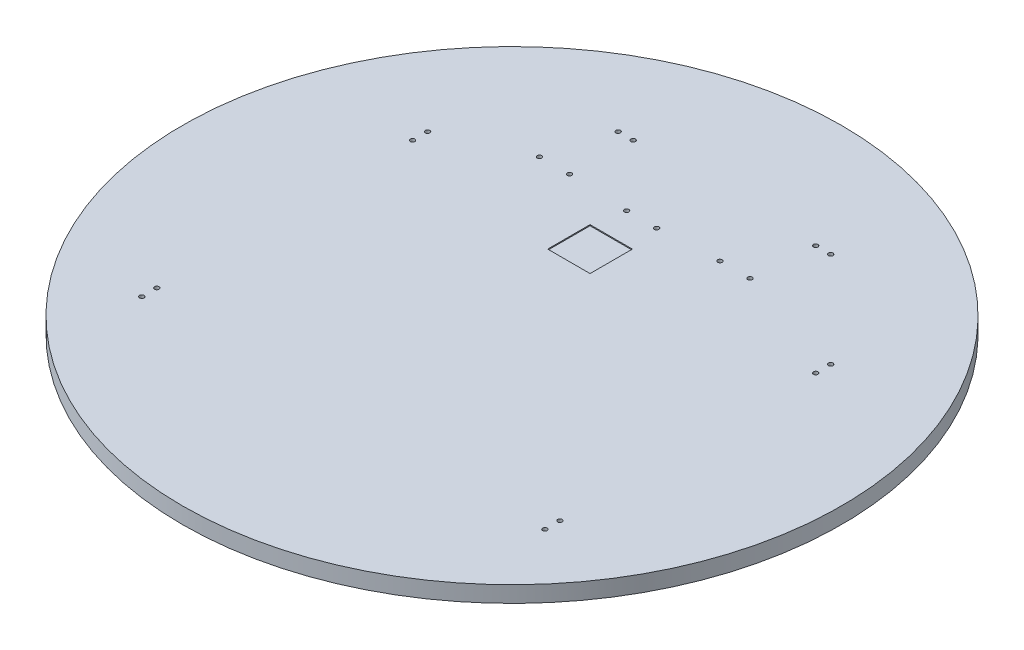
from build123d import *

# Parameters (mm, degrees)
SKETCH1_R           = 328.6125
BOSS_EXTRUDE1_DEPTH = 16.1798
SKETCH3_R           = 2.25
CUT_EXTRUDE1_DEPTH  = 780.013065513
SKETCH4_W           = 42.25
SKETCH4_H           = 42.25
CUT_EXTRUDE2_DEPTH  = 1
SKETCH5_R           = 3.75
CUT_EXTRUDE3_DEPTH  = 7.5


with BuildPart() as part:
    # Sketch1 → Boss-Extrude1 (new body)
    with BuildSketch(Plane(origin=(0, 0, 0), x_dir=(1, 0, 0), z_dir=(0, 1, 0))):
        with Locations(Location((216.675, 227.5, 0), (0, 0, 270))):
            Circle(SKETCH1_R)
    extrude(amount=BOSS_EXTRUDE1_DEPTH)

    # Sketch3 → Cut-Extrude1 (cut, through all)
    with BuildSketch(Plane(origin=(0, 16.1798, 0), x_dir=(1, 0, 0), z_dir=(0, 1, 0))):
        with Locations(Location((322.675, 439.325, 0), (0, 0, 270))):
            Circle(SKETCH3_R)
        with Locations(Location((307.675, 439.325, 0), (0, 0, 270))):
            Circle(SKETCH3_R)
        with Locations(Location((110.675, 439.325, 0), (0, 0, 270))):
            Circle(SKETCH3_R)
        with Locations(Location((125.675, 439.325, 0), (0, 0, 270))):
            Circle(SKETCH3_R)
        with Locations(Location((183.215, 375.2, 0), (0, 0, 270))):
            Circle(SKETCH3_R)
        with Locations(Location((213.215, 375.2, 0), (0, 0, 270))):
            Circle(SKETCH3_R)
        with Locations(Location((15.675, 329.325, 0), (0, 0, 270))):
            Circle(SKETCH3_R)
        with Locations(Location((15.675, 344.325, 0), (0, 0, 270))):
            Circle(SKETCH3_R)
        with Locations(Location((417.675, 329.325, 0), (0, 0, 270))):
            Circle(SKETCH3_R)
        with Locations(Location((417.675, 344.325, 0), (0, 0, 270))):
            Circle(SKETCH3_R)
        with Locations(Location((417.675, 59.325, 0), (0, 0, 270))):
            Circle(SKETCH3_R)
        with Locations(Location((417.675, 74.325, 0), (0, 0, 270))):
            Circle(SKETCH3_R)
        with Locations(Location((15.675, 59.325, 0), (0, 0, 270))):
            Circle(SKETCH3_R)
        with Locations(Location((15.675, 74.325, 0), (0, 0, 270))):
            Circle(SKETCH3_R)
        with Locations(Location((303.215, 378.325, 0), (0, 0, 270))):
            Circle(SKETCH3_R)
        with Locations(Location((273.215, 378.325, 0), (0, 0, 270))):
            Circle(SKETCH3_R)
        with Locations(Location((123.215, 378.325, 0), (0, 0, 270))):
            Circle(SKETCH3_R)
        with Locations(Location((93.215, 378.325, 0), (0, 0, 270))):
            Circle(SKETCH3_R)
    extrude(amount=-CUT_EXTRUDE1_DEPTH, mode=Mode.SUBTRACT)

    # Sketch4 → Cut-Extrude2 (cut)
    with BuildSketch(Plane(origin=(0, 16.1798, 0), x_dir=(1, 0, 0), z_dir=(0, 1, 0))):
        with Locations((198.125, 323.875)):
            Rectangle(SKETCH4_W, SKETCH4_H)
    extrude(amount=-CUT_EXTRUDE2_DEPTH, mode=Mode.SUBTRACT)

    # Sketch5 → Cut-Extrude3 (cut)
    with BuildSketch(Plane.XZ):
        with Locations(Location((15.675, -59.325, 0), (0, 0, 270))):
            Circle(SKETCH5_R)
        with Locations(Location((15.675, -74.325, 0), (0, 0, 270))):
            Circle(SKETCH5_R)
        with Locations(Location((15.675, -344.325, 0), (0, 0, 270))):
            Circle(SKETCH5_R)
        with Locations(Location((15.675, -329.325, 0), (0, 0, 270))):
            Circle(SKETCH5_R)
        with Locations(Location((93.215, -378.325, 0), (0, 0, 270))):
            Circle(SKETCH5_R)
        with Locations(Location((123.215, -378.325, 0), (0, 0, 270))):
            Circle(SKETCH5_R)
        with Locations(Location((183.215, -375.2, 0), (0, 0, 270))):
            Circle(SKETCH5_R)
        with Locations(Location((213.215, -375.2, 0), (0, 0, 270))):
            Circle(SKETCH5_R)
        with Locations(Location((273.215, -378.325, 0), (0, 0, 270))):
            Circle(SKETCH5_R)
        with Locations(Location((125.675, -439.325, 0), (0, 0, 270))):
            Circle(SKETCH5_R)
        with Locations(Location((110.675, -439.325, 0), (0, 0, 270))):
            Circle(SKETCH5_R)
        with Locations(Location((303.215, -378.325, 0), (0, 0, 270))):
            Circle(SKETCH5_R)
        with Locations(Location((307.675, -439.325, 0), (0, 0, 270))):
            Circle(SKETCH5_R)
        with Locations(Location((322.675, -439.325, 0), (0, 0, 270))):
            Circle(SKETCH5_R)
        with Locations(Location((417.675, -344.325, 0), (0, 0, 270))):
            Circle(SKETCH5_R)
        with Locations(Location((417.675, -329.325, 0), (0, 0, 270))):
            Circle(SKETCH5_R)
        with Locations(Location((417.675, -74.325, 0), (0, 0, 270))):
            Circle(SKETCH5_R)
        with Locations(Location((417.675, -59.325, 0), (0, 0, 270))):
            Circle(SKETCH5_R)
    extrude(amount=-CUT_EXTRUDE3_DEPTH, mode=Mode.SUBTRACT)


solid = part.part
